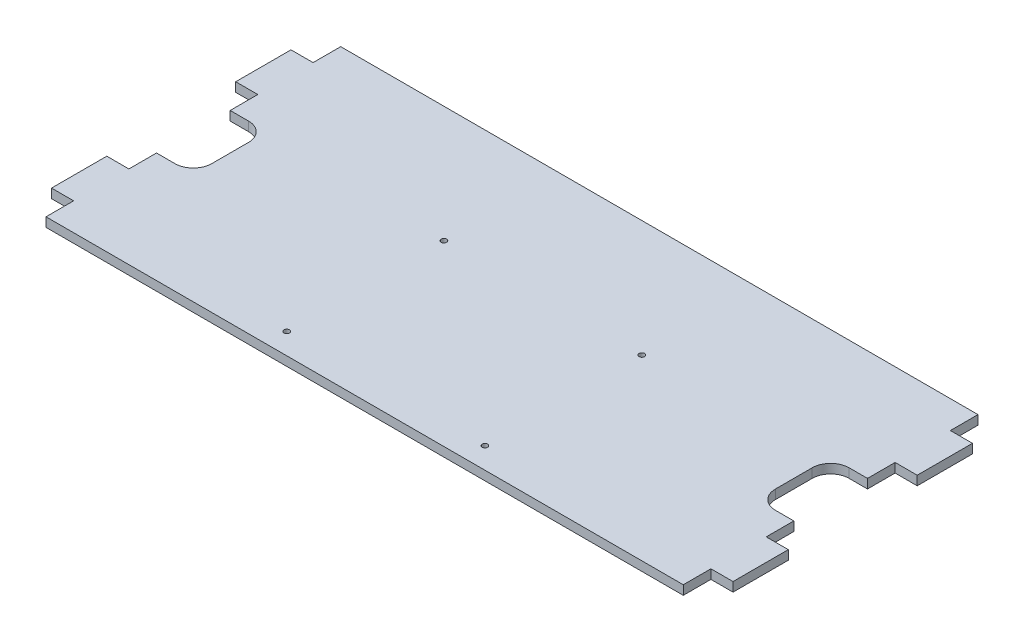
from build123d import *

# Parameters (mm, degrees)
EXTRUDE_1_DEPTH     = 5
SKETCH_2_R          = 1.5
CUT_EXTRUDE_1_DEPTH = 202.618451537


with BuildPart() as part:
    # 草圖1 → 填料-伸長1 (new body)
    with BuildSketch(Plane(origin=(0, 0, 0), x_dir=(1, 0, 0), z_dir=(0, 1, 0))):
        Polygon((173, -65), (185, -65), (185, -35), (173, -35), (173, 35), (185, 35), (185, 65), (173, 65), (173, 80), (-173, 80), (-173, 65), (-185, 65), (-185, 35), (-173, 35), (-173, -35), (-185, -35), (-185, -65), (-173, -65), (-173, -80), (173, -80), align=None)
    extrude(amount=EXTRUDE_1_DEPTH)

    # 草圖2 → 除料-伸長1 (cut, through all)
    with BuildSketch(Plane(origin=(0, 5, 0), x_dir=(1, 0, 0), z_dir=(0, 1, 0))):
        with Locations(Location((-53.75, 16.75, 0), (0, 0, 270))):
            Circle(SKETCH_2_R)
        with Locations(Location((53.75, 16.75, 0), (0, 0, 90))):
            Circle(SKETCH_2_R)
        with Locations(Location((53.75, -68.5, 0), (0, 0, 270))):
            Circle(SKETCH_2_R)
        with Locations(Location((-53.75, -68.5, 0), (0, 0, 90))):
            Circle(SKETCH_2_R)
        with BuildLine():
            Line((-173, -20), (-163, -20))
            ThreePointArc((-163, -20), (-155.928932188, -17.071067812), (-153, -10))
            Line((-153, -10), (-153, 10))
            ThreePointArc((-153, 10), (-155.928932188, 17.071067812), (-163, 20))
            Line((-163, 20), (-173, 20))
            Line((-173, 20), (-173, -20))
        make_face()
        with BuildLine():
            Line((173, 20), (163, 20))
            ThreePointArc((163, 20), (155.928932188, 17.071067812), (153, 10))
            Line((153, 10), (153, -10))
            ThreePointArc((153, -10), (155.928932188, -17.071067812), (163, -20))
            Line((163, -20), (173, -20))
            Line((173, -20), (173, 20))
        make_face()
    extrude(amount=-CUT_EXTRUDE_1_DEPTH, mode=Mode.SUBTRACT)


solid = part.part
